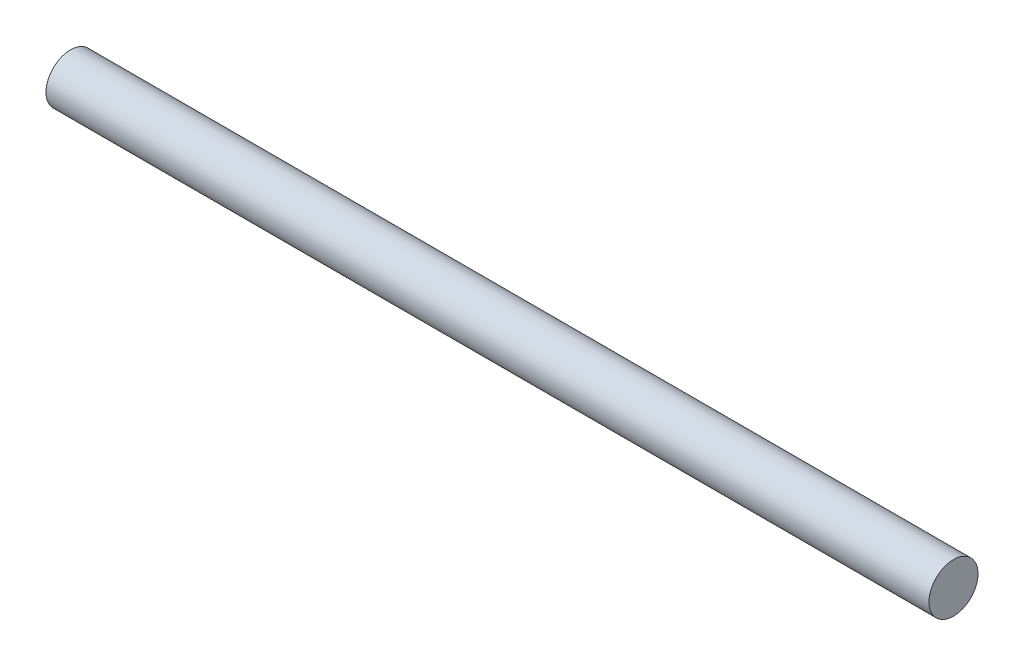
from build123d import *

# Parameters (mm, degrees)
SKETCH1_R           = 2.5
BOSS_EXTRUDE1_DEPTH = 90


with BuildPart() as part:
    # Sketch1 → Boss-Extrude1 (new body)
    with BuildSketch(Plane(origin=(0, 0, 0), x_dir=(0, 0, -1), z_dir=(1, 0, 0))):
        with Locations(Location((0, 0, 0), (0, 0, 180))):
            Circle(SKETCH1_R)
    extrude(amount=BOSS_EXTRUDE1_DEPTH)


solid = part.part
